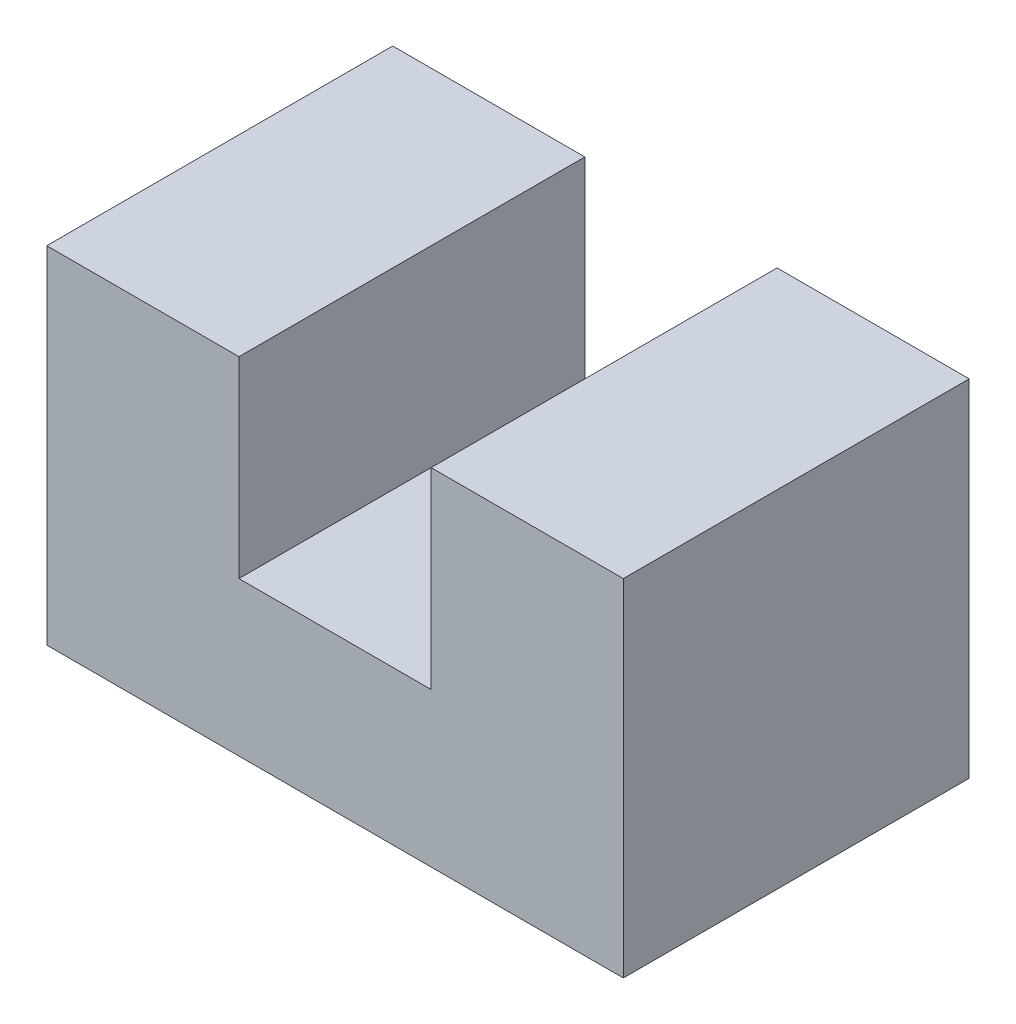
from build123d import *

# Parameters (mm, degrees)
EXTRUSION1_DEPTH = 30


with BuildPart() as part:
    # Esquisse1 → Extrusion1 (new, symmetric)
    with BuildSketch(Plane.XY):
        Polygon((0, 0), (100, 0), (100, 60), (66.666666667, 60), (66.666666667, 26.666666667), (33.333333333, 26.666666667), (33.333333333, 60), (0, 60), align=None)
    extrude(amount=EXTRUSION1_DEPTH, both=True)


solid = part.part
